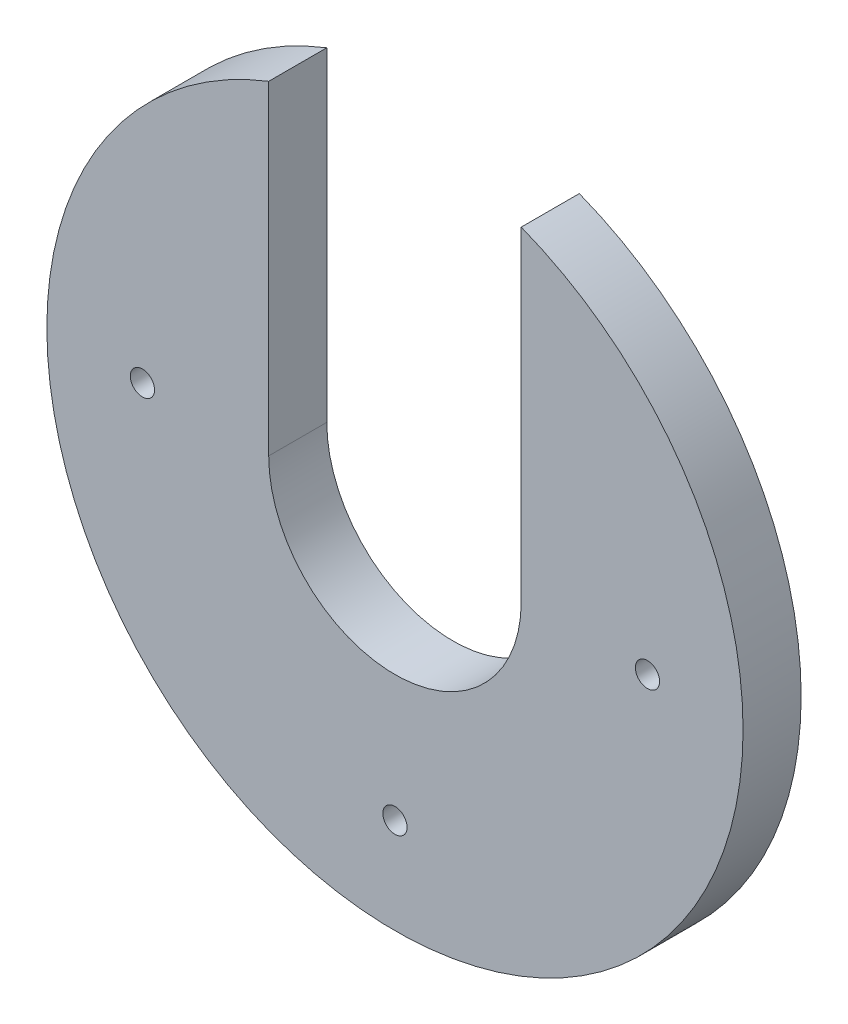
from build123d import *

# Parameters (mm, degrees)
SKETCH1_R           = 1.2192
BOSS_EXTRUDE1_DEPTH = 5.842


with BuildPart() as part:
    # Sketch1 → Boss-Extrude1 (new body)
    with BuildSketch(Plane.XY):
        with BuildLine():
            Line((12.7, 32.629483496), (12.7, 0))
            ThreePointArc((12.7, 0), (0, -12.7), (-12.7, 0))
            Line((-12.7, 0), (-12.7, 32.629483496))
            ThreePointArc((-12.7, 32.629483496), (-19.764825615, -28.901987157), (35.0139, 0))
            ThreePointArc((35.0139, 0), (28.901987157, 19.764825615), (12.7, 32.629483496))
        make_face()
        with Locations((0, -25.4)):
            Circle(SKETCH1_R, mode=Mode.SUBTRACT)
        with Locations((-25.4, 0)):
            Circle(SKETCH1_R, mode=Mode.SUBTRACT)
        with Locations((25.4, 0)):
            Circle(SKETCH1_R, mode=Mode.SUBTRACT)
    extrude(amount=BOSS_EXTRUDE1_DEPTH)


solid = part.part
